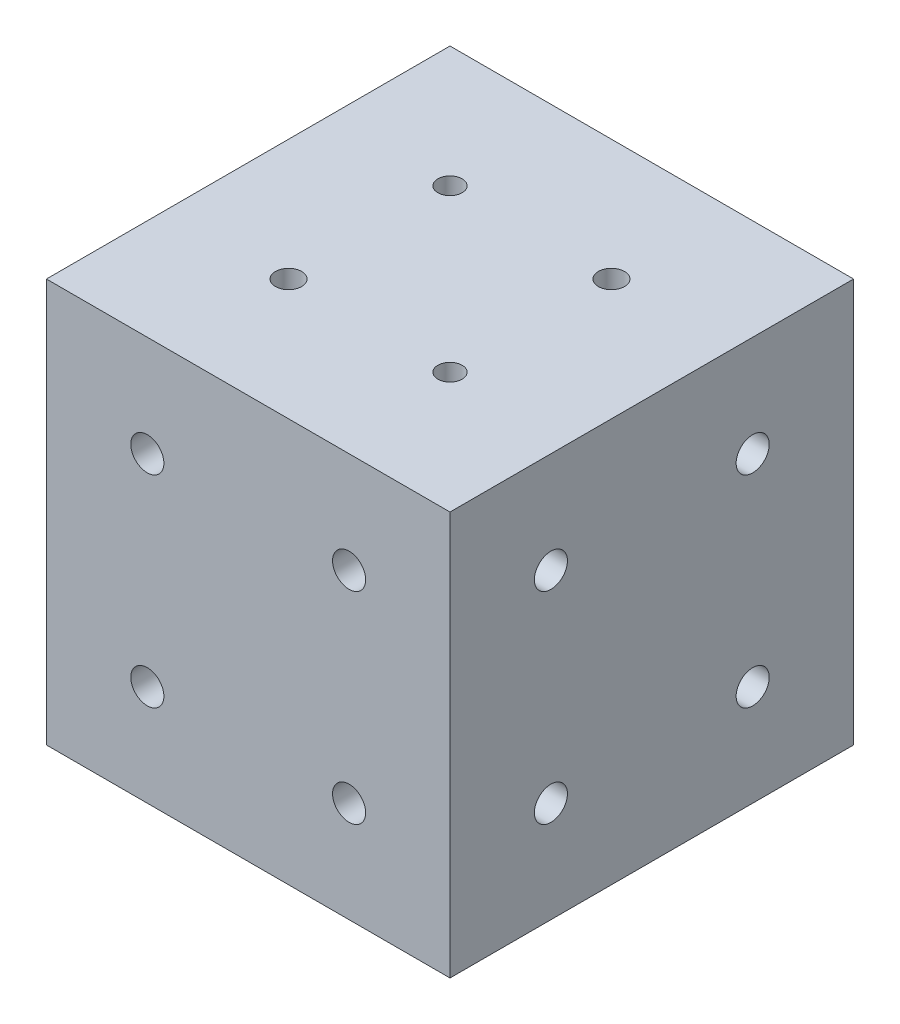
from build123d import *

# Parameters (mm, degrees)
SKETCH1_W           = 100
SKETCH1_H           = 100
BOSS_EXTRUDE1_DEPTH = 50
SKETCH2_R           = 4.1
CUT_EXTRUDE1_DEPTH  = 123.474487139
SKETCH3_R           = 4.1
CUT_EXTRUDE2_DEPTH  = 123.474487139
SKETCH4_R           = 3
SKETCH4_R_2         = 3.25
CUT_EXTRUDE3_DEPTH  = 123.474487139
SKETCH8_W           = 85
SKETCH8_H           = 85
CUT_EXTRUDE4_DEPTH  = 40


with BuildPart() as part:
    # Sketch1 → Boss-Extrude1 (new, symmetric)
    with BuildSketch(Plane.XY):
        Rectangle(SKETCH1_W, SKETCH1_H)
    extrude(amount=BOSS_EXTRUDE1_DEPTH, both=True)

    # Sketch2 → Cut-Extrude1 (cut, through all)
    with BuildSketch(Plane.XY.offset(50)):
        with Locations((-25, 25)):
            Circle(SKETCH2_R)
        with Locations((25, 25)):
            Circle(SKETCH2_R)
        with Locations((25, -25)):
            Circle(SKETCH2_R)
        with Locations((-25, -25)):
            Circle(SKETCH2_R)
    extrude(amount=-CUT_EXTRUDE1_DEPTH, mode=Mode.SUBTRACT)

    # Sketch3 → Cut-Extrude2 (cut, through all)
    with BuildSketch(Plane(origin=(50, 0, 0), x_dir=(0, 0, -1), z_dir=(1, 0, 0))):
        with Locations((-25, 25)):
            Circle(SKETCH3_R)
        with Locations((25, 25)):
            Circle(SKETCH3_R)
        with Locations(Location((25, -25, 0), (0, 0, 90))):
            Circle(SKETCH3_R)
        with Locations(Location((-25, -25, 0), (0, 0, 270))):
            Circle(SKETCH3_R)
    extrude(amount=-CUT_EXTRUDE2_DEPTH, mode=Mode.SUBTRACT)

    # Sketch4 → Cut-Extrude3 (cut, through all)
    with BuildSketch(Plane(origin=(0, 50, 0), x_dir=(1, 0, 0), z_dir=(0, 1, 0))):
        with Locations(Location((-20, 20, 0), (0, 0, 270))):
            Circle(SKETCH4_R)
        with Locations(Location((20, -20, 0), (0, 0, 270))):
            Circle(SKETCH4_R)
        with Locations(Location((20, 20, 0), (0, 0, 270))):
            Circle(SKETCH4_R_2)
        with Locations(Location((-20, -20, 0), (0, 0, 270))):
            Circle(SKETCH4_R_2)
    extrude(amount=-CUT_EXTRUDE3_DEPTH, mode=Mode.SUBTRACT)

    # Sketch8 → Cut-Extrude4 (cut, symmetric)
    with BuildSketch(Plane(origin=(0, 0, 0), x_dir=(1, 0, 0), z_dir=(0, 1, 0))):
        Rectangle(SKETCH8_W, SKETCH8_H)
    extrude(amount=CUT_EXTRUDE4_DEPTH, both=True, mode=Mode.SUBTRACT)


solid = part.part
